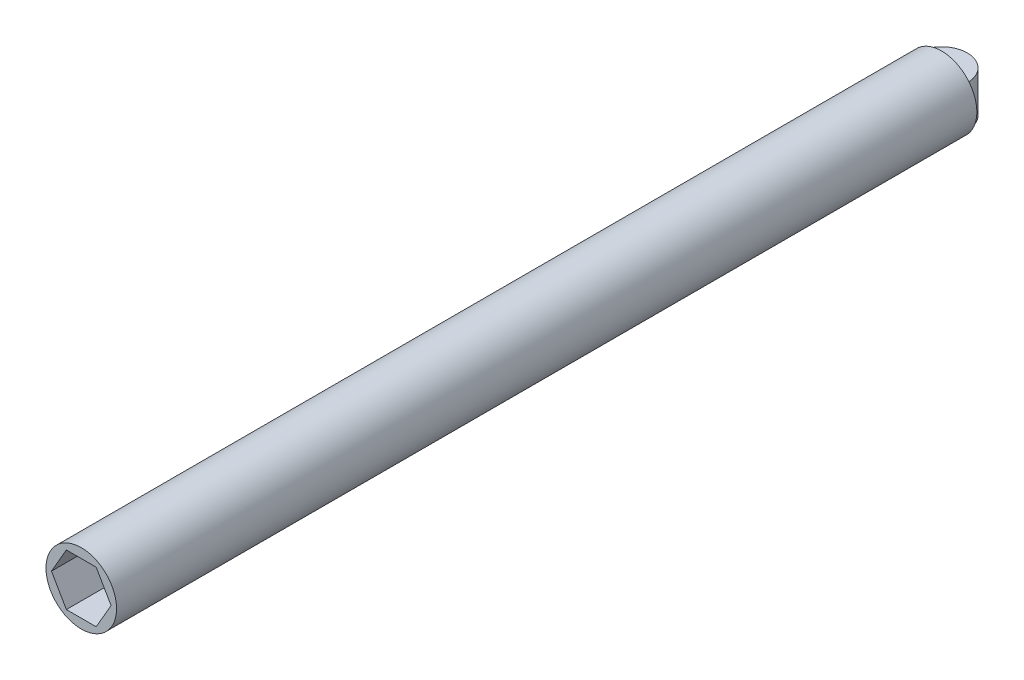
from build123d import *

# Parameters (mm, degrees)
SKETCH1_R                = 1.025
BOSS_EXTRUDE1_DEPTH      = 12
CUT_EXTRUDE1_DEPTH       = 7
BOSS_EXTRUDE2_START      = 4
SKETCH3_R                = 1.025
BOSS_EXTRUDE2_DEPTH      = 4
SKETCH6_R                = 1.025
BOSS_EXTRUDE5_DEPTH      = 7
BOSS_EXTRUDE6_START      = 2
SKETCH7_R                = 1.025
BOSS_EXTRUDE6_DEPTH      = 2
BOSS_EXTRUDE8_DEPTH      = 0.6
BOSS_EXTRUDE8_DEPTH_BACK = 0.6


with BuildPart() as part:
    # Sketch1 → Boss-Extrude1 (new body)
    with BuildSketch(Plane.XY):
        Circle(SKETCH1_R)
    extrude(amount=BOSS_EXTRUDE1_DEPTH)

    # Sketch2 → Cut-Extrude1 (cut)
    with BuildSketch(Plane.XY.offset(12)):
        Polygon((0.866025404, 0), (0.433012702, 0.75), (-0.433012702, 0.75), (-0.866025404, 0), (-0.433012702, -0.75), (0.433012702, -0.75), align=None)
    extrude(amount=-CUT_EXTRUDE1_DEPTH, mode=Mode.SUBTRACT)

    # Sketch3 → Boss-Extrude2 (add)
    with BuildSketch(Plane(origin=(0, 0, 0), x_dir=(-1, 0, 0), z_dir=(0, 0, -1)).offset(BOSS_EXTRUDE2_START)):
        Circle(SKETCH3_R)
    extrude(amount=-BOSS_EXTRUDE2_DEPTH)

    # Sketch6 → Boss-Extrude5 (add)
    with BuildSketch(Plane.XY.offset(12)):
        with Locations(Location((0, 0, 0), (0, 0, 180))):
            Circle(SKETCH6_R)
        Polygon((0.866025404, 0), (0.433012702, 0.75), (-0.433012702, 0.75), (-0.866025404, 0), (-0.433012702, -0.75), (0.433012702, -0.75), align=None, mode=Mode.SUBTRACT)
    extrude(amount=BOSS_EXTRUDE5_DEPTH)

    # Sketch7 → Boss-Extrude6 (add)
    with BuildSketch(Plane(origin=(0, 0, -4), x_dir=(-1, 0, 0), z_dir=(0, 0, -1)).offset(BOSS_EXTRUDE6_START)):
        Circle(SKETCH7_R)
    extrude(amount=-BOSS_EXTRUDE6_DEPTH)

    # Sketch8 → Boss-Extrude8 (add, two sides: drawn at the far end of the back side and taken through both)
    with BuildSketch(Plane(origin=(0, 0, 0), x_dir=(1, 0, 0), z_dir=(0, 1, 0)).offset(-BOSS_EXTRUDE8_DEPTH_BACK)):
        with BuildLine():
            ThreePointArc((0.75, 6), (0, 6.75), (-0.75, 6))
            Line((-0.75, 6), (0.75, 6))
        make_face()
        with BuildLine():
            Line((0.75, 6), (-0.75, 6))
            ThreePointArc((-0.75, 6), (0, 5.25), (0.75, 6))
        make_face()
    extrude(amount=BOSS_EXTRUDE8_DEPTH + BOSS_EXTRUDE8_DEPTH_BACK)


solid = part.part
